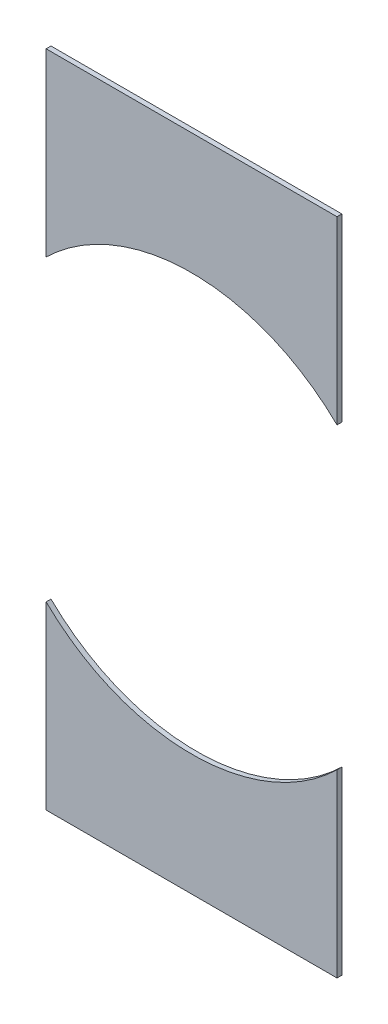
from build123d import *

# Parameters (mm, degrees)
SALIENTE_EXTRUIR1_DEPTH   = 1
SALIENTE_EXTRUIR1_2_DEPTH = 1


with BuildPart() as part:
    # Croquis1 → Saliente-Extruir1 (new body)
    with BuildSketch(Plane.XY):
        with BuildLine():
            Line((30, 68), (-30, 68))
            Line((-30, 68), (-30, 30.805843601))
            ThreePointArc((-30, 30.805843601), (0, 43), (30, 30.805843601))
            Line((30, 30.805843601), (30, 68))
        make_face()
    extrude(amount=SALIENTE_EXTRUIR1_DEPTH)


with BuildPart() as body_2:
    # Croquis1 → Saliente-Extruir1 2 (new body)
    with BuildSketch(Plane.XY):
        with BuildLine():
            ThreePointArc((30, -30.805843601), (0, -43), (-30, -30.805843601))
            Line((-30, -30.805843601), (-30, -68))
            Line((-30, -68), (30, -68))
            Line((30, -68), (30, -30.805843601))
        make_face()
    extrude(amount=SALIENTE_EXTRUIR1_2_DEPTH)


solid = Compound([part.part, body_2.part])
